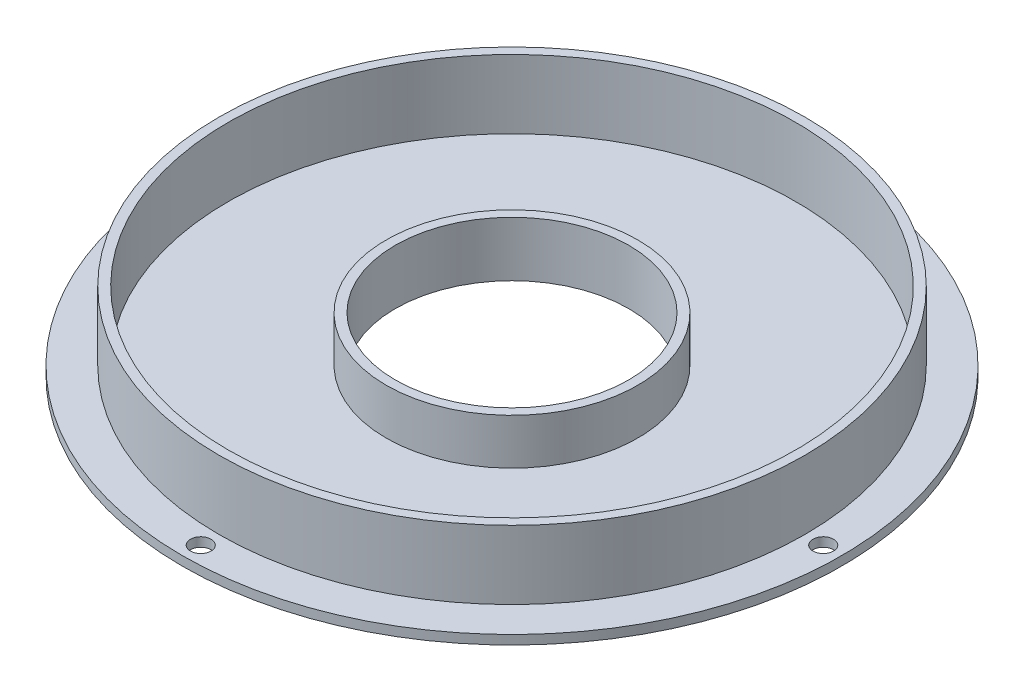
from build123d import *

# Parameters (mm, degrees)
SKETCH1_R           = 72
SKETCH1_R_2         = 2.25
SKETCH1_R_3         = 25.5
BOSS_EXTRUDE1_DEPTH = 2
SKETCH2_R           = 27.5
SKETCH2_R_2         = 25.5
BOSS_EXTRUDE2_DEPTH = 10
SKETCH3_R           = 64
SKETCH3_R_2         = 62
BOSS_EXTRUDE3_DEPTH = 15


with BuildPart() as part:
    # Sketch1 → Boss-Extrude1 (new body)
    with BuildSketch(Plane(origin=(0, 0, 0), x_dir=(1, 0, 0), z_dir=(0, 1, 0))):
        with Locations(Location((0, 0, 0), (0, 0, 270))):
            Circle(SKETCH1_R)
        with Locations(Location((68, 0, 0), (0, 0, 270))):
            Circle(SKETCH1_R_2, mode=Mode.SUBTRACT)
        with Locations(Location((0, -68, 0), (0, 0, 270))):
            Circle(SKETCH1_R_2, mode=Mode.SUBTRACT)
        with Locations(Location((-68, 0, 0), (0, 0, 270))):
            Circle(SKETCH1_R_2, mode=Mode.SUBTRACT)
        with Locations(Location((0, 68, 0), (0, 0, 270))):
            Circle(SKETCH1_R_2, mode=Mode.SUBTRACT)
        with Locations(Location((0, 0, 0), (0, 0, 270))):
            Circle(SKETCH1_R_3, mode=Mode.SUBTRACT)
    extrude(amount=BOSS_EXTRUDE1_DEPTH)

    # Sketch2 → Boss-Extrude2 (add)
    with BuildSketch(Plane(origin=(0, 2, 0), x_dir=(1, 0, 0), z_dir=(0, 1, 0))):
        with Locations(Location((0, 0, 0), (0, 0, 270))):
            Circle(SKETCH2_R)
        with Locations(Location((0, 0, 0), (0, 0, 270))):
            Circle(SKETCH2_R_2, mode=Mode.SUBTRACT)
    extrude(amount=BOSS_EXTRUDE2_DEPTH)

    # Sketch3 → Boss-Extrude3 (add)
    with BuildSketch(Plane(origin=(0, 2, 0), x_dir=(1, 0, 0), z_dir=(0, 1, 0))):
        with Locations(Location((0, 0, 0), (0, 0, 270))):
            Circle(SKETCH3_R)
        with Locations(Location((0, 0, 0), (0, 0, 270))):
            Circle(SKETCH3_R_2, mode=Mode.SUBTRACT)
    extrude(amount=BOSS_EXTRUDE3_DEPTH)


solid = part.part
